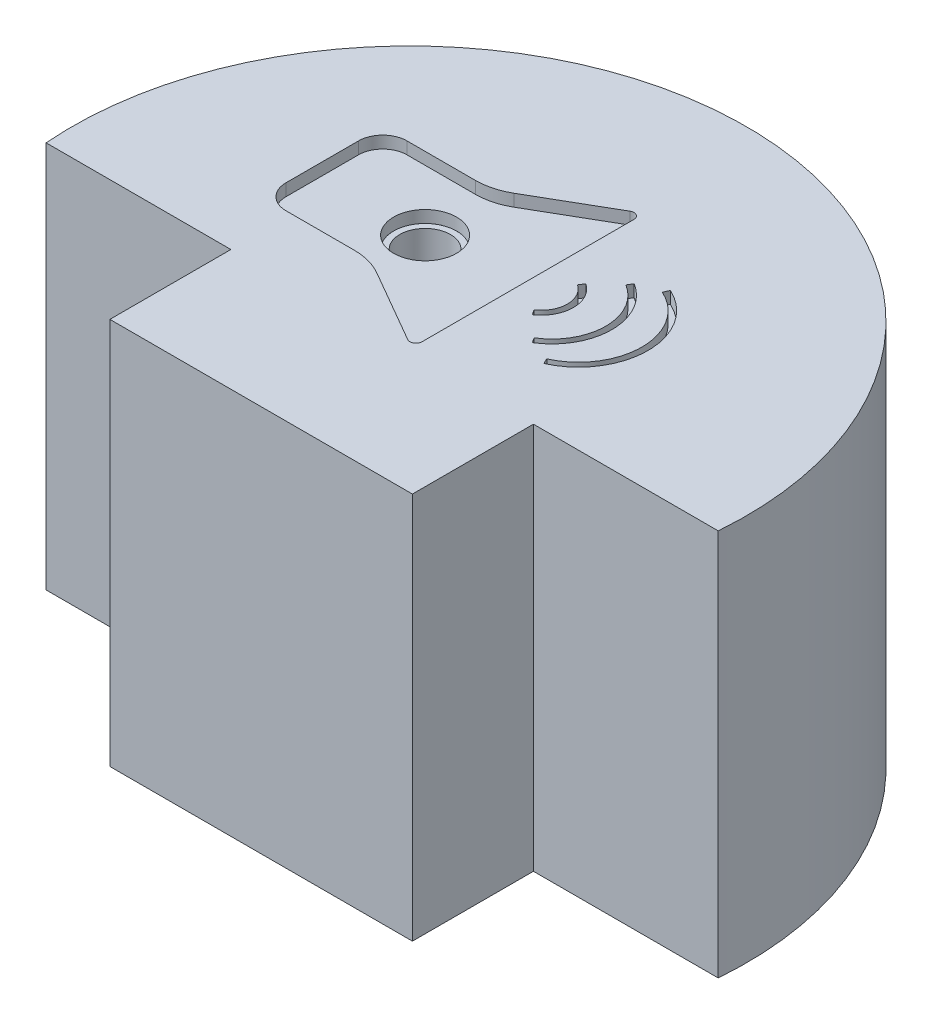
from build123d import *

# Parameters (mm, degrees)
EXTRUIR_L_MINA1_DEPTH        = 30
SALIENTE_EXTRUIR1_DEPTH      = 2
CORTAR_EXTRUIR1_DEPTH        = 1
CORTAR_EXTRUIR_L_MINA2_DEPTH = 1
CROQUIS5_W                   = 20
CROQUIS5_H                   = 0.5
EXTRUIR_L_MINA2_DEPTH        = 1
CROQUIS6_W                   = 10
CROQUIS6_H                   = 0.5
EXTRUIR_L_MINA3_DEPTH        = 1
CROQUIS7_R                   = 2.6
CORTAR_EXTRUIR2_DEPTH        = 11
CROQUIS8_R                   = 2.6
CROQUIS8_R_2                 = 2.1
SALIENTE_EXTRUIR2_DEPTH      = 3


with BuildPart() as part:
    # Croquis1 → Extruir-Lámina1 (new body)
    with BuildSketch(Plane(origin=(0, 0, 0), x_dir=(1, 0, 0), z_dir=(0, 1, 0))):
        with BuildLine():
            Line((-27.77, 10), (-12.5, 10))
            Line((-12.5, 10), (-12.5, 0))
            Line((-12.5, 0), (12.5, 0))
            Line((12.5, 0), (12.5, 10))
            Line((12.5, 10), (27.77, 10))
            ThreePointArc((27.77, 10), (0, 40.097565641), (-27.77, 10))
        make_face()
        with BuildLine():
            Line((-25.858908766, 12), (-10.5, 12))
            Line((-10.5, 12), (-10.5, 2))
            Line((-10.5, 2), (10.5, 2))
            Line((10.5, 2), (10.5, 12))
            Line((10.5, 12), (25.858908766, 12))
            ThreePointArc((25.858908766, 12), (0, 38.097565641), (-25.858908766, 12))
        make_face(mode=Mode.SUBTRACT)
    extrude(amount=EXTRUIR_L_MINA1_DEPTH)

    # Croquis2 → Saliente-Extruir1 (add)
    with BuildSketch(Plane(origin=(0, 30, 0), x_dir=(1, 0, 0), z_dir=(0, 1, 0))):
        with BuildLine():
            Line((12.5, 10), (27.77, 10))
            ThreePointArc((27.77, 10), (0, 40.097565641), (-27.77, 10))
            Line((-27.77, 10), (-12.5, 10))
            Line((-12.5, 10), (-12.5, 0))
            Line((-12.5, 0), (12.5, 0))
            Line((12.5, 0), (12.5, 10))
        make_face()
    extrude(amount=SALIENTE_EXTRUIR1_DEPTH)

    # Croquis3 → Cortar-Extruir1 (cut)
    with BuildSketch(Plane(origin=(0, 32, 0), x_dir=(1, 0, 0), z_dir=(0, 1, 0))):
        with BuildLine():
            Line((-15, 23.048782821), (-15, 17.048782821))
            ThreePointArc((-15, 17.048782821), (-14.414213562, 15.634569258), (-13, 15.048782821))
            Line((-13, 15.048782821), (-7.339745962, 15.048782821))
            ThreePointArc((-7.339745962, 15.048782821), (-6.045650737, 14.878411952), (-4.839745962, 14.37890984))
            Line((-4.839745962, 14.37890984), (1.25, 10.862993369))
            ThreePointArc((1.25, 10.862993369), (1.75, 10.862993369), (2, 11.296006071))
            Line((2, 11.296006071), (2, 28.80155957))
            ThreePointArc((2, 28.80155957), (1.75, 29.234572272), (1.25, 29.234572272))
            Line((1.25, 29.234572272), (-4.839745962, 25.718655802))
            ThreePointArc((-4.839745962, 25.718655802), (-6.045650737, 25.219153689), (-7.339745962, 25.048782821))
            Line((-7.339745962, 25.048782821), (-13, 25.048782821))
            ThreePointArc((-13, 25.048782821), (-14.414213562, 24.462996383), (-15, 23.048782821))
        make_face()
    extrude(amount=-CORTAR_EXTRUIR1_DEPTH, mode=Mode.SUBTRACT)

    # Croquis4 → Cortar-Extruir-Lámina2 (cut)
    with BuildSketch(Plane(origin=(0, 32, 0), x_dir=(1, 0, 0), z_dir=(0, 1, 0))):
        with BuildLine():
            ThreePointArc((4.344585076, 21.79004299), (5.307052977, 19.99849463), (4.344585076, 18.206946269))
            Line((4.344585076, 18.206946269), (4.620613436, 17.79004299))
            ThreePointArc((4.620613436, 17.79004299), (5.807052977, 19.99849463), (4.620613436, 22.206946269))
            Line((4.620613436, 22.206946269), (4.344585076, 21.79004299))
        make_face()
        with BuildLine():
            ThreePointArc((6.352562942, 23.784975176), (8.479957679, 19.99849463), (6.352562942, 16.212014083))
            Line((6.352562942, 16.212014083), (6.612635571, 15.784975176))
            ThreePointArc((6.612635571, 15.784975176), (8.979957679, 19.99849463), (6.612635571, 24.212014083))
            Line((6.612635571, 24.212014083), (6.352562942, 23.784975176))
        make_face()
        with BuildLine():
            ThreePointArc((8.380144543, 24.770452897), (11.467649375, 19.99849463), (8.380144543, 15.226536362))
            Line((8.380144543, 15.226536362), (8.58505397, 14.770452897))
            ThreePointArc((8.58505397, 14.770452897), (11.967649375, 19.99849463), (8.58505397, 25.226536362))
            Line((8.58505397, 25.226536362), (8.380144543, 24.770452897))
        make_face()
    extrude(amount=-CORTAR_EXTRUIR_L_MINA2_DEPTH, mode=Mode.SUBTRACT)

    # Croquis5 → Extruir-Lámina2 (add)
    with BuildSketch(Plane(origin=(0, 0, -2), x_dir=(-1, 0, 0), z_dir=(0, 0, -1))):
        with Locations((0, 5.1)):
            Rectangle(CROQUIS5_W, CROQUIS5_H)
    extrude(amount=EXTRUIR_L_MINA2_DEPTH)

    # Croquis6 → Extruir-Lámina3 (add)
    with BuildSketch(Plane(origin=(0, 0, -12), x_dir=(-1, 0, 0), z_dir=(0, 0, -1))):
        with Locations((-18.5, 5.1)):
            Rectangle(CROQUIS6_W, CROQUIS6_H)
        with Locations((18.5, 5.1)):
            Rectangle(CROQUIS6_W, CROQUIS6_H)
    extrude(amount=EXTRUIR_L_MINA3_DEPTH)

    # Croquis7 → Cortar-Extruir2 (cut)
    with BuildSketch(Plane(origin=(0, 32, 0), x_dir=(1, 0, 0), z_dir=(0, 1, 0))):
        with Locations(Location((-6.5, 20.048782821, 0), (0, 0, 270))):
            Circle(CROQUIS7_R)
    extrude(amount=-CORTAR_EXTRUIR2_DEPTH, mode=Mode.SUBTRACT)


with BuildPart() as body_2:
    # Croquis8 → Saliente-Extruir2 (new body)
    with BuildSketch(Plane.XZ.offset(-30)):
        with Locations(Location((-6.5, -20.048782821, 0), (0, 0, 270))):
            Circle(CROQUIS8_R)
        with Locations(Location((-6.5, -20.048782821, 0), (0, 0, 270))):
            Circle(CROQUIS8_R_2, mode=Mode.SUBTRACT)
    extrude(amount=SALIENTE_EXTRUIR2_DEPTH)


solid = Compound([part.part, body_2.part])
